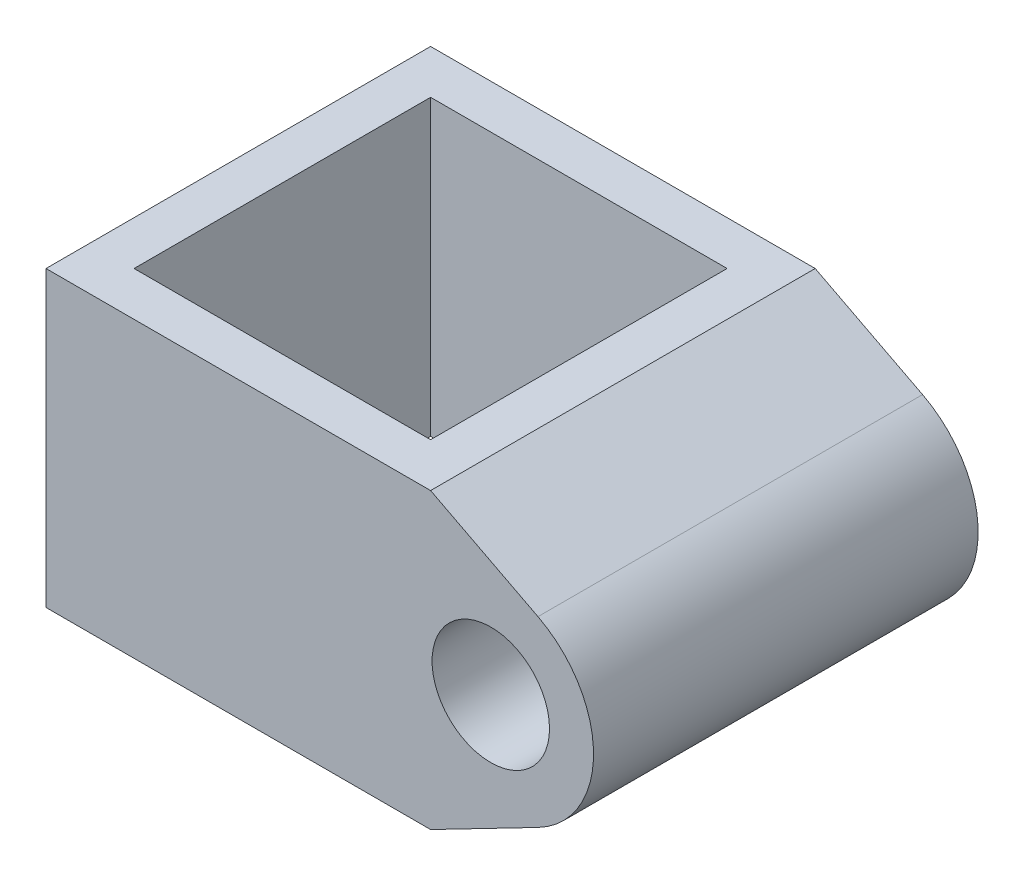
from build123d import *

# Parameters (mm, degrees)
SKETCH1_W           = 26.2
SKETCH1_H           = 26.2
SKETCH1_W_2         = 20.2
SKETCH1_H_2         = 20.2
BOSS_EXTRUDE1_DEPTH = 20
SKETCH2_R           = 4
BOSS_EXTRUDE4_DEPTH = 26.2


with BuildPart() as part:
    # Sketch1 → Boss-Extrude1 (new body)
    with BuildSketch(Plane(origin=(0, 0, 0), x_dir=(1, 0, 0), z_dir=(0, 1, 0))):
        with Locations((10.1, 10.1)):
            Rectangle(SKETCH1_W, SKETCH1_H)
        with Locations((10.1, 10.1)):
            Rectangle(SKETCH1_W_2, SKETCH1_H_2, mode=Mode.SUBTRACT)
    extrude(amount=BOSS_EXTRUDE1_DEPTH)

    # Sketch2 → Boss-Extrude4 (add)
    # profile 1 of 3: a face of its own
    with BuildSketch(Plane.XY.offset(3)):
        with BuildLine():
            ThreePointArc((34.3, 10), (33.279298444, 13.639778856), (30.514859965, 16.218092586))
            ThreePointArc((30.514859965, 16.218092586), (26.780404048, 16.980689081), (23.2, 15.673623181))
            Line((23.2, 15.673623181), (23.2, 4.326376819))
            ThreePointArc((23.2, 4.326376819), (26.780404048, 3.019310919), (30.514859965, 3.781907414))
            ThreePointArc((30.514859965, 3.781907414), (33.279298444, 6.360221144), (34.3, 10))
        make_face()
        with Locations((27.3, 10)):
            Circle(SKETCH2_R, mode=Mode.SUBTRACT)
    # profile 2 of 3: a face of its own
    with BuildSketch(Plane.XY.offset(3)):
        with BuildLine():
            Line((30.514859965, 16.218092586), (23.2, 20))
            Line((23.2, 20), (23.2, 15.673623181))
            ThreePointArc((23.2, 15.673623181), (26.780404048, 16.980689081), (30.514859965, 16.218092586))
        make_face()
    # profile 3 of 3: a face of its own
    with BuildSketch(Plane.XY.offset(3)):
        with BuildLine():
            ThreePointArc((30.514859965, 3.781907414), (26.780404048, 3.019310919), (23.2, 4.326376819))
            Line((23.2, 4.326376819), (23.2, 0))
            Line((23.2, 0), (30.514859965, 3.781907414))
        make_face()
    extrude(amount=-BOSS_EXTRUDE4_DEPTH)


solid = part.part
